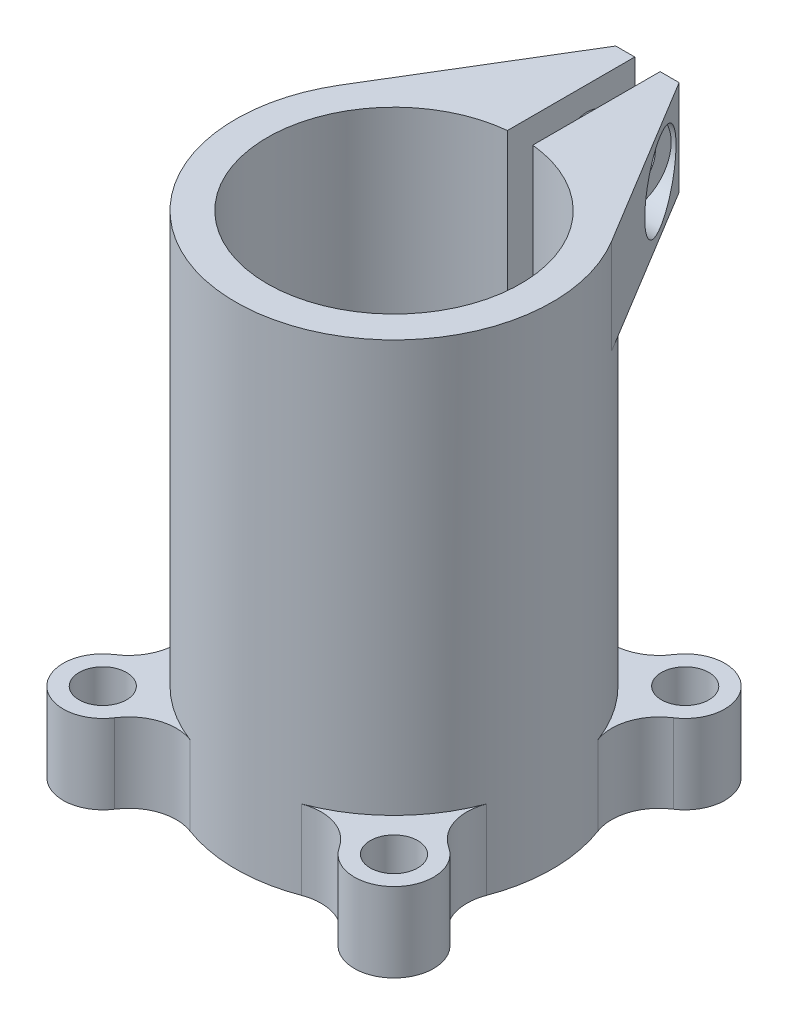
from build123d import *

# Parameters (mm, degrees)
SKETCH_1_R               = 1.5
EXTRUDE_1_DEPTH          = 5
SKETCH_2_R               = 10
EXTRUDE_2_DEPTH          = 26
SKETCH_3_R               = 8
CUT_EXTRUDE_1_DEPTH      = 36.134368951
EXTRUDE_START            = -6
EXTRUDE_3_DEPTH          = 6
SKETCH_5_W               = 1.6
SKETCH_5_H               = 16
CUT_EXTRUDE_2_DEPTH      = 25
CUT_EXTRUDE_3_DEPTH      = 37.792824583
CUT_EXTRUDE_3_DEPTH_BACK = 37.792824583
SKETCH_6_R               = 1.5
SKETCH_7_R               = 2.5
CUT_EXTRUDE_4_DEPTH      = 8


with BuildPart() as part:
    # 草图1 → 凸台-拉伸1 (new body)
    with BuildSketch(Plane(origin=(0, 0, 0), x_dir=(1, 0, 0), z_dir=(0, 1, 0))):
        with BuildLine():
            ThreePointArc((7.090675644, 10.546199264), (5.511531927, 9.322805199), (3.514323561, 9.362132765))
            ThreePointArc((3.514323561, 9.362132765), (0, 10), (-3.514323561, 9.362132765))
            ThreePointArc((-3.514323561, 9.362132765), (-5.511531927, 9.322805199), (-7.090675644, 10.546199264))
            ThreePointArc((-7.090675644, 10.546199264), (-10.960155108, 10.960155108), (-10.546199264, 7.090675644))
            ThreePointArc((-10.546199264, 7.090675644), (-9.322805199, 5.511531927), (-9.362132765, 3.514323561))
            ThreePointArc((-9.362132765, 3.514323561), (-10, 0), (-9.362132765, -3.514323561))
            ThreePointArc((-9.362132765, -3.514323561), (-9.322805199, -5.511531927), (-10.546199264, -7.090675644))
            ThreePointArc((-10.546199264, -7.090675644), (-10.960155108, -10.960155108), (-7.090675644, -10.546199264))
            ThreePointArc((-7.090675644, -10.546199264), (-5.511531927, -9.322805199), (-3.514323561, -9.362132765))
            ThreePointArc((-3.514323561, -9.362132765), (0, -10), (3.514323561, -9.362132765))
            ThreePointArc((3.514323561, -9.362132765), (5.511531927, -9.322805199), (7.090675644, -10.546199264))
            ThreePointArc((7.090675644, -10.546199264), (10.960155108, -10.960155108), (10.546199264, -7.090675644))
            ThreePointArc((10.546199264, -7.090675644), (9.322805199, -5.511531927), (9.362132765, -3.514323561))
            ThreePointArc((9.362132765, -3.514323561), (10, 0), (9.362132765, 3.514323561))
            ThreePointArc((9.362132765, 3.514323561), (9.322805199, 5.511531927), (10.546199264, 7.090675644))
            ThreePointArc((10.546199264, 7.090675644), (10.960155108, 10.960155108), (7.090675644, 10.546199264))
        make_face()
        with Locations(Location((-9.192388155, -9.192388155, 0), (0, 0, 270))):
            Circle(SKETCH_1_R, mode=Mode.SUBTRACT)
        with Locations(Location((9.192388155, -9.192388155, 0), (0, 0, 270))):
            Circle(SKETCH_1_R, mode=Mode.SUBTRACT)
        with Locations(Location((-9.192388155, 9.192388155, 0), (0, 0, 270))):
            Circle(SKETCH_1_R, mode=Mode.SUBTRACT)
        with Locations(Location((9.192388155, 9.192388155, 0), (0, 0, 270))):
            Circle(SKETCH_1_R, mode=Mode.SUBTRACT)
    extrude(amount=EXTRUDE_1_DEPTH)

    # 草图2 → 凸台-拉伸2 (add)
    with BuildSketch(Plane(origin=(0, 5, 0), x_dir=(1, 0, 0), z_dir=(0, 1, 0))):
        with Locations(Location((0, 0, 0), (0, 0, 69.425050538))):
            Circle(SKETCH_2_R)
    extrude(amount=EXTRUDE_2_DEPTH)

    # 草图3 → 切除-拉伸1 (cut, through all)
    with BuildSketch(Plane(origin=(0, 31, 0), x_dir=(1, 0, 0), z_dir=(0, 1, 0))):
        with Locations(Location((0, 0, 0), (0, 0, 270))):
            Circle(SKETCH_3_R)
    extrude(amount=-CUT_EXTRUDE_1_DEPTH, mode=Mode.SUBTRACT)

    # 草图4 → 凸台-拉伸3 (add)
    with BuildSketch(Plane(origin=(0, 31, 0), x_dir=(1, 0, 0), z_dir=(0, 1, 0)).offset(EXTRUDE_START)):
        with BuildLine():
            Line((-8.553298856, 5.180837643), (-2, 16))
            Line((-2, 16), (2, 16))
            Line((2, 16), (8.553298856, 5.180837643))
            ThreePointArc((8.553298856, 5.180837643), (0, 10), (-8.553298856, 5.180837643))
        make_face()
    extrude(amount=EXTRUDE_3_DEPTH)

    # 草图5 → 切除-拉伸2 (cut)
    with BuildSketch(Plane(origin=(0, 31, 0), x_dir=(1, 0, 0), z_dir=(0, 1, 0))):
        with Locations((0, 8)):
            Rectangle(SKETCH_5_W, SKETCH_5_H)
    extrude(amount=-CUT_EXTRUDE_2_DEPTH, mode=Mode.SUBTRACT)

    # 草图6 → 切除-拉伸3 (cut, two sides: drawn at the far end of the back side and taken through both)
    with BuildSketch(Plane(origin=(0, 0, 0), x_dir=(0, 0, -1), z_dir=(1, 0, 0)).offset(-CUT_EXTRUDE_3_DEPTH_BACK)):
        with Locations((13, 28)):
            Circle(SKETCH_6_R)
    extrude(amount=CUT_EXTRUDE_3_DEPTH + CUT_EXTRUDE_3_DEPTH_BACK, mode=Mode.SUBTRACT)

    # 草图7 → 切除-拉伸4 (cut)
    with BuildSketch(Plane(origin=(10, 0, 0), x_dir=(0, 0, -1), z_dir=(1, 0, 0))):
        with Locations((13, 28)):
            Circle(SKETCH_7_R)
    extrude(amount=-CUT_EXTRUDE_4_DEPTH, mode=Mode.SUBTRACT)


solid = part.part
